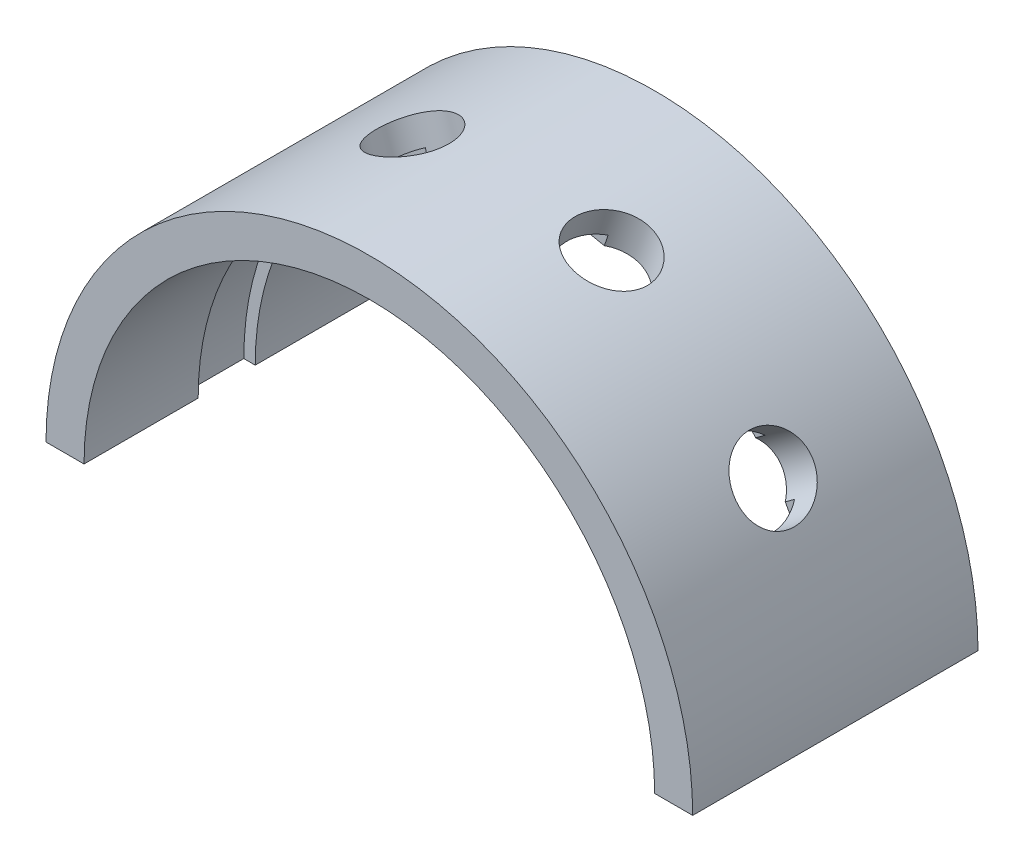
from build123d import *

# Parameters (mm, degrees)
CIRPATTERN1_COUNT = 4
CIRPATTERN1_ANGLE = 108


with BuildPart() as part:
    # Sweep1: sweep along a path in Sketch1
    with BuildLine(Plane.XY) as sweep1_path:
        ThreePointArc((-8.5, 0), (0, 8.5), (8.5, 0))
    # Sketch2 → Sweep1 (sweep)
    with BuildSketch(Plane(origin=(0, 0, 0), x_dir=(1, 0, 0), z_dir=(0, 1, 0))):
        Polygon((-7.5, -3.75), (-7.5, -0.75), (-7.8, -0.75), (-7.8, 0.75), (-7.5, 0.75), (-7.5, 3.75), (-8.5, 3.75), (-8.5, -3.75), align=None)
    sweep(path=sweep1_path.line)

    # Sketch3 → Cut-Revolve1 (revolve, cut)
    with BuildSketch(Plane.XY):
        Polygon((4.938511893, 3.588038915), (15.375889989, 11.171237983), (15.963675241, 10.362220989), (5.526297145, 2.779021921), align=None)
    cut_revolve1 = revolve(axis=Axis((4.938511893, 3.588038915, 0), (0.8090169943749489, 0.5877852522924712, 0)), mode=Mode.SUBTRACT)

    # CirPattern1: Cut-Revolve1 ×4 about axis
    cirpattern1_axis = Axis((0, 0, -11.55), (0, 0, 1))
    for i in range(1, CIRPATTERN1_COUNT):
        add(cut_revolve1.rotate(cirpattern1_axis, i * CIRPATTERN1_ANGLE / (CIRPATTERN1_COUNT - 1)), mode=Mode.SUBTRACT)


solid = part.part
